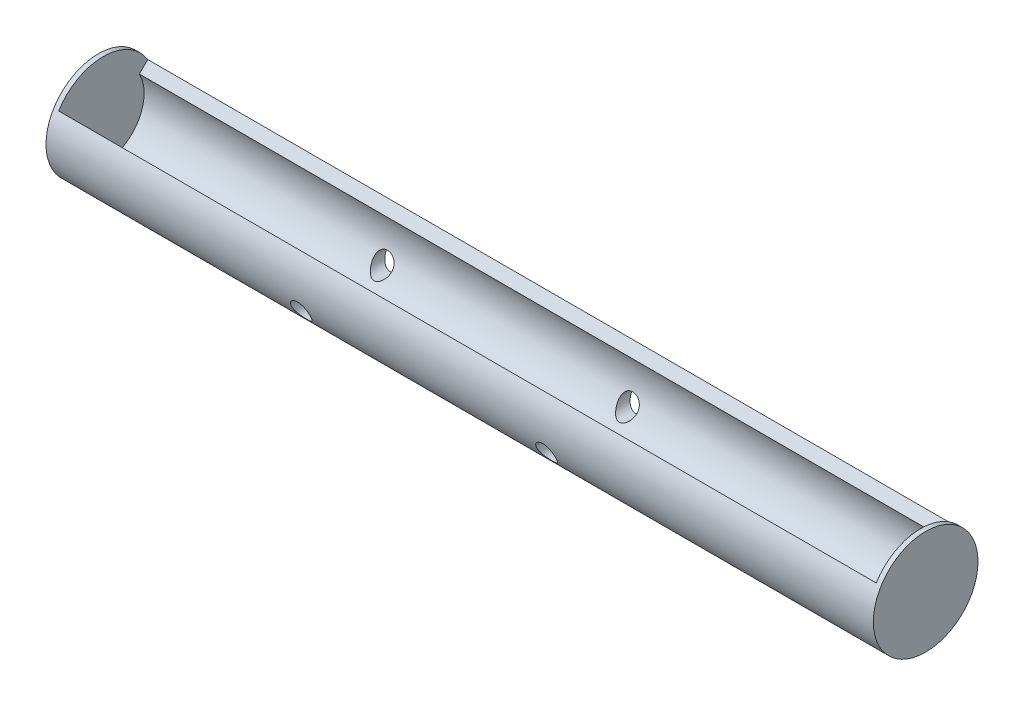
from build123d import *
from build123d.topology import SkipClean

# Parameters (mm, degrees)
RESSALTO_EXTRUS_O1_DEPTH          = 250
CORTE_EXTRUS_O2_REACH             = 256.063
ESBO_O4_R                         = 6
CORTE_EXTRUS_O2_DIRECTION_2_REACH = 256.063
RESSALTO_EXTRUS_O2_START          = 3
ESBO_O5_R                         = 32
RESSALTO_EXTRUS_O2_DEPTH          = 3
ESBO_O6_R                         = 32
RESSALTO_EXTRUS_O3_DEPTH          = 3


with BuildPart() as part:
    # Esboço1 → Ressalto-extrusão1 (new, symmetric)
    with BuildSketch(Plane(origin=(0, 0, 0), x_dir=(0, 0, -1), z_dir=(1, 0, 0))):
        with BuildLine():
            Line((22.115498803, 11.657817664), (27.241951671, 16.789165231))
            ThreePointArc((27.241951671, 16.789165231), (0.001842805, -31.999999947), (-27.243885188, 16.786027518))
            Line((-27.243885188, 16.786027518), (-22.115498803, 11.657817664))
            ThreePointArc((-22.115498803, 11.657817664), (0, -25), (22.115498803, 11.657817664))
        make_face()
    extrude(amount=RESSALTO_EXTRUS_O1_DEPTH, both=True)

    # Esboço4 → Corte-extrusão2 (cut, up to next)
    with BuildSketch(Plane.XY, mode=Mode.PRIVATE) as corte_extrus_o2_sk1:
        with Locations(Location((50, -13.525079078, 0), (0, 0, 180))):
            Circle(ESBO_O4_R)
    corte_extrus_o2_tool1 = extrude(corte_extrus_o2_sk1.sketch, amount=-CORTE_EXTRUS_O2_REACH, mode=Mode.PRIVATE) & part.part
    # Esboço4 → Corte-extrusão2 (cut, up to next)
    with BuildSketch(Plane.XY, mode=Mode.PRIVATE) as corte_extrus_o2_sk2:
        with Locations(Location((-100, -13.525079078, 0), (0, 0, 180))):
            Circle(ESBO_O4_R)
    corte_extrus_o2_tool2 = extrude(corte_extrus_o2_sk2.sketch, amount=-CORTE_EXTRUS_O2_REACH, mode=Mode.PRIVATE) & part.part
    add(corte_extrus_o2_tool1.solids().sort_by_distance((50, -13.525079, 0))[0], mode=Mode.SUBTRACT)
    add(corte_extrus_o2_tool2.solids().sort_by_distance((-100, -13.525079, 0))[0], mode=Mode.SUBTRACT)

    # Esboço4 → Corte-extrusão2 direction 2 (cut, up to next)
    with BuildSketch(Plane.XY, mode=Mode.PRIVATE) as corte_extrus_o2_direction_2_sk1:
        with Locations(Location((50, -13.525079078, 0), (0, 0, 180))):
            Circle(ESBO_O4_R)
    corte_extrus_o2_direction_2_tool1 = extrude(corte_extrus_o2_direction_2_sk1.sketch, amount=CORTE_EXTRUS_O2_DIRECTION_2_REACH, mode=Mode.PRIVATE) & part.part
    # Esboço4 → Corte-extrusão2 direction 2 (cut, up to next)
    with BuildSketch(Plane.XY, mode=Mode.PRIVATE) as corte_extrus_o2_direction_2_sk2:
        with Locations(Location((-100, -13.525079078, 0), (0, 0, 180))):
            Circle(ESBO_O4_R)
    corte_extrus_o2_direction_2_tool2 = extrude(corte_extrus_o2_direction_2_sk2.sketch, amount=CORTE_EXTRUS_O2_DIRECTION_2_REACH, mode=Mode.PRIVATE) & part.part
    add(corte_extrus_o2_direction_2_tool1.solids().sort_by_distance((50, -13.525079, 0))[0], mode=Mode.SUBTRACT)
    add(corte_extrus_o2_direction_2_tool2.solids().sort_by_distance((-100, -13.525079, 0))[0], mode=Mode.SUBTRACT)

    # Esboço5 → Ressalto-extrusão2 (add)
    with SkipClean():  # the faces are left unmerged after this step: merging them gives an invalid solid
        with BuildSketch(Plane(origin=(250, 0, 0), x_dir=(0, 0, -1), z_dir=(1, 0, 0)).offset(RESSALTO_EXTRUS_O2_START)):
            with Locations(Location((0, 0, 0), (0, 0, 148.36114649))):
                Circle(ESBO_O5_R)
        extrude(amount=-RESSALTO_EXTRUS_O2_DEPTH)

    # Esboço6 → Ressalto-extrusão3 (add)
    with SkipClean():  # the faces are left unmerged after this step: merging them gives an invalid solid
        with BuildSketch(Plane.ZY.offset(250)):
            Circle(ESBO_O6_R)
        extrude(amount=RESSALTO_EXTRUS_O3_DEPTH)


solid = part.part
